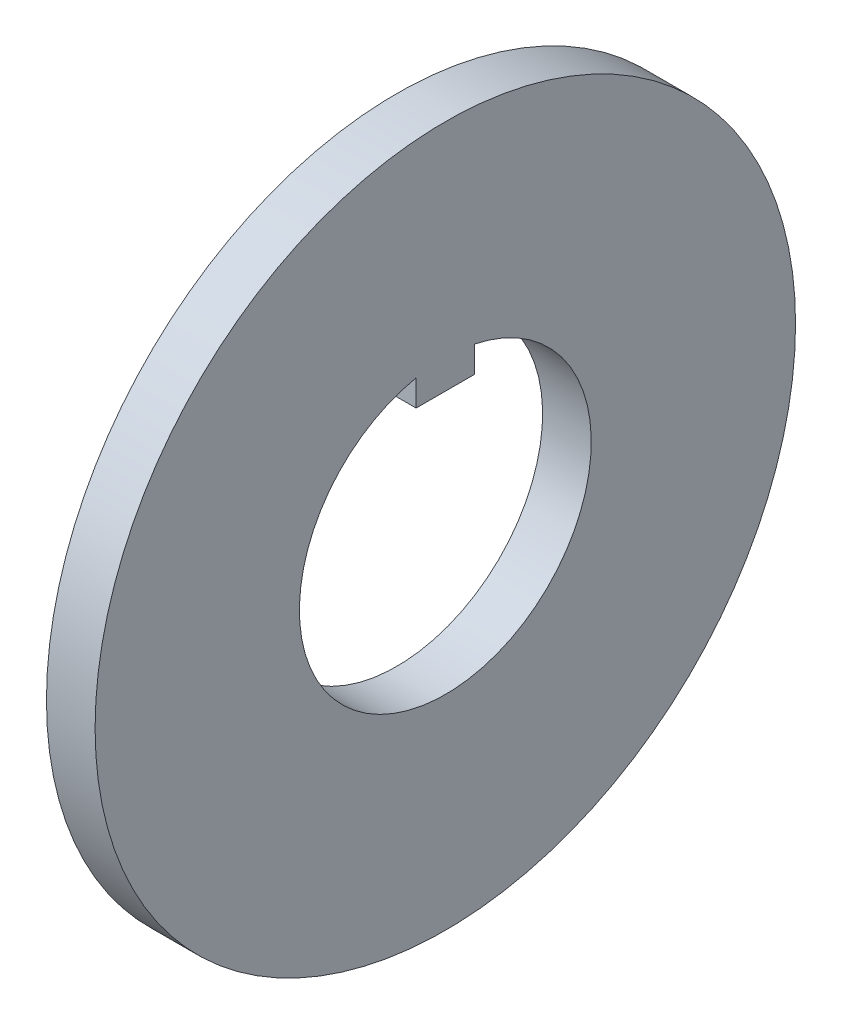
from build123d import *

# Parameters (mm, degrees)
SKETCH1_R           = 91.44
BOSS_EXTRUDE1_DEPTH = 12.7
CUT_EXTRUDE1_DEPTH  = 12.7


with BuildPart() as part:
    # Sketch1 → Boss-Extrude1 (new body)
    with BuildSketch(Plane(origin=(0, 0, 0), x_dir=(0, 0, -1), z_dir=(1, 0, 0))):
        Circle(SKETCH1_R)
    extrude(amount=BOSS_EXTRUDE1_DEPTH)

    # Sketch2 → Cut-Extrude1 (cut)
    with BuildSketch(Plane(origin=(12.7, 0, 0), x_dir=(0, 0, -1), z_dir=(1, 0, 0))):
        with BuildLine():
            Line((7.62, 37.33022368), (7.62, 30.48))
            Line((7.62, 30.48), (-7.62, 30.48))
            Line((-7.62, 30.48), (-7.62, 37.33022368))
            ThreePointArc((-7.62, 37.33022368), (0, -38.1), (7.62, 37.33022368))
        make_face()
    extrude(amount=-CUT_EXTRUDE1_DEPTH, mode=Mode.SUBTRACT)


solid = part.part
